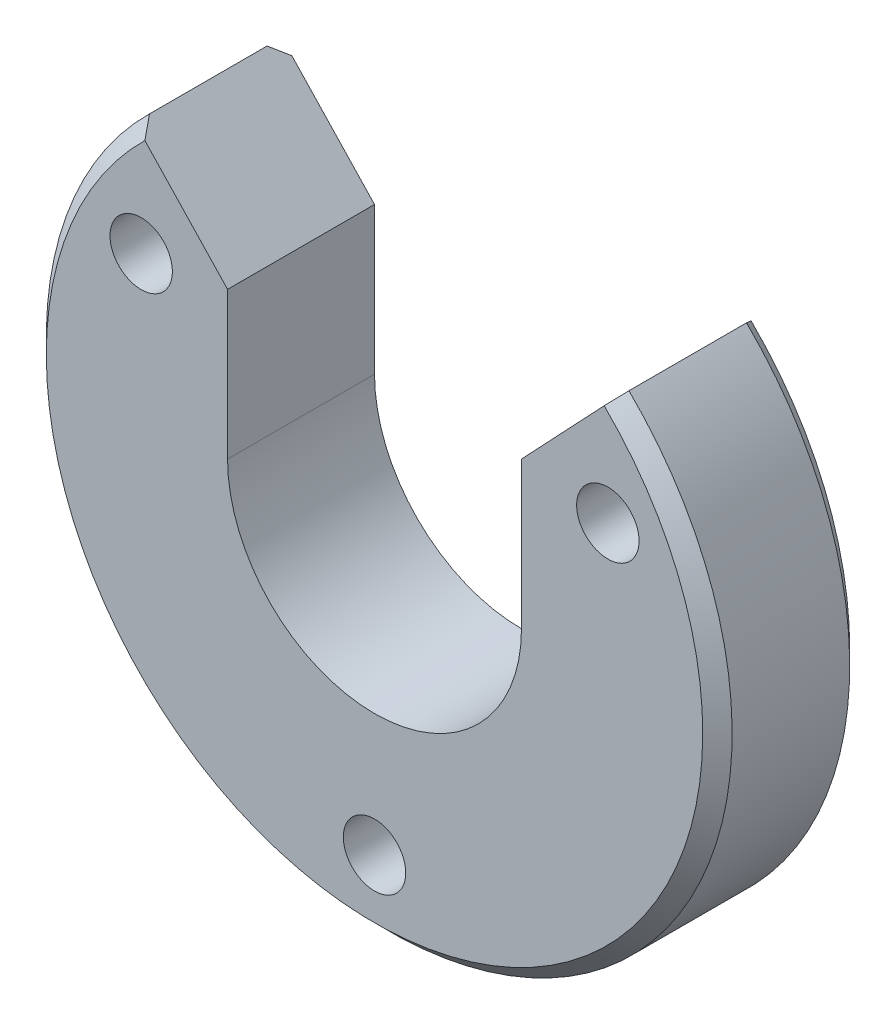
from build123d import *

# Parameters (mm, degrees)
SKETCH_1_R          = 14
SKETCH_1_R_2        = 6
EXTRUDE_1_DEPTH     = 6
SKETCH_2_R          = 1.273771183
CUT_EXTRUDE_1_DEPTH = 21.688160866
CUT_EXTRUDE_2_DEPTH = 21.688160866
CHAMFER_1_SIZE      = 0.6


with BuildPart() as part:
    # 草圖1 → 填料-伸長1 (new body)
    with BuildSketch(Plane.XY):
        Circle(SKETCH_1_R)
        Circle(SKETCH_1_R_2, mode=Mode.SUBTRACT)
    extrude(amount=EXTRUDE_1_DEPTH)

    # 草圖2 → 除料-伸長1 (cut, through all)
    with BuildSketch(Plane.XY.offset(6)):
        with Locations((0, -11)):
            Circle(SKETCH_2_R)
        with Locations((-9.526279442, 5.5)):
            Circle(SKETCH_2_R)
        with Locations((9.526279442, 5.5)):
            Circle(SKETCH_2_R)
    extrude(amount=-CUT_EXTRUDE_1_DEPTH, mode=Mode.SUBTRACT)

    # 草圖3 → 除料-伸長2 (cut, through all)
    with BuildSketch(Plane.XY.offset(6)):
        with BuildLine():
            Line((6, 0), (6, 6))
            Line((6, 6), (9.787707238, 10.010034317))
            ThreePointArc((9.787707238, 10.010034317), (0, 14), (-9.787707238, 10.010034317))
            Line((-9.787707238, 10.010034317), (-6, 6))
            Line((-6, 6), (-6, 0))
            Line((-6, 0), (6, 0))
        make_face()
    extrude(amount=-CUT_EXTRUDE_2_DEPTH, mode=Mode.SUBTRACT)

    # 導角1
    chamfer_1_edges = [part.edges().sort_by_distance(p)[0] for p in [
        (0, -14, 6),
        (0, -14, 0),
    ]]
    chamfer(chamfer_1_edges, length=CHAMFER_1_SIZE)


solid = part.part
